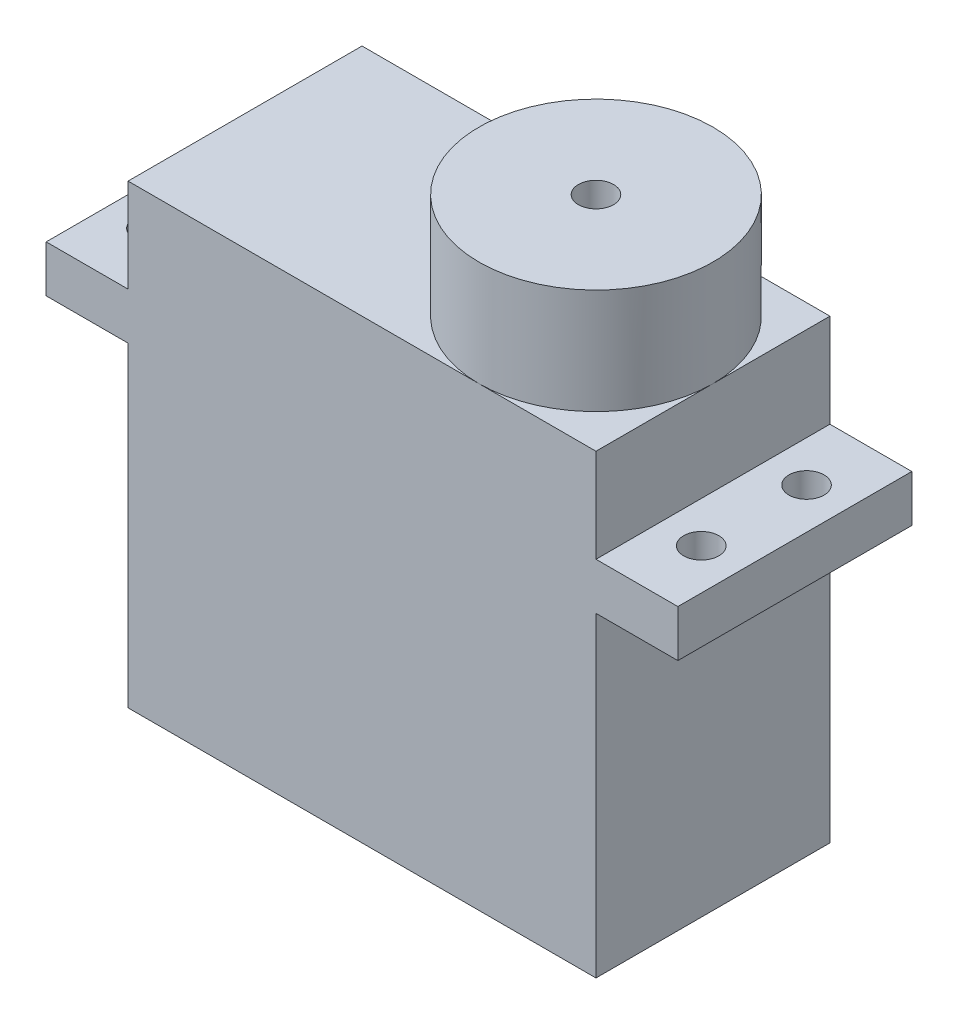
from build123d import *

# Parameters (mm, degrees)
SKETCH_1_W          = 40
SKETCH_1_H          = 20
EXTRUDE_1_DEPTH     = 39
SKETCH_2_W          = 20
SKETCH_2_H          = 4
EXTRUDE_2_DEPTH     = 7
SKETCH_3_R          = 1.5
CUT_EXTRUDE_1_DEPTH = 4
SKETCH_4_W          = 7
SKETCH_4_H          = 4
EXTRUDE_3_DEPTH     = 20
SKETCH_5_R          = 1.5
CUT_EXTRUDE_2_DEPTH = 4
SKETCH_6_R          = 10
EXTRUDE_4_DEPTH     = 9
SKETCH_7_R          = 1.5
CUT_EXTRUDE_3_DEPTH = 6


with BuildPart() as part:
    # Эскиз1 → Бобышка-Вытянуть1 (new body)
    with BuildSketch(Plane(origin=(0, 0, 0), x_dir=(1, 0, 0), z_dir=(0, 1, 0))):
        Rectangle(SKETCH_1_W, SKETCH_1_H)
    extrude(amount=EXTRUDE_1_DEPTH)

    # Эскиз2 → Бобышка-Вытянуть2 (add)
    with BuildSketch(Plane(origin=(20, 0, 0), x_dir=(0, 0, -1), z_dir=(1, 0, 0))):
        with Locations((0, 29)):
            Rectangle(SKETCH_2_W, SKETCH_2_H)
    extrude(amount=EXTRUDE_2_DEPTH)

    # Эскиз3 → Вырез-Вытянуть1 (cut)
    with BuildSketch(Plane(origin=(0, 31, 0), x_dir=(1, 0, 0), z_dir=(0, 1, 0))):
        with Locations(Location((23.5, 4.5, 0), (0, 0, 270))):
            Circle(SKETCH_3_R)
        with Locations(Location((23.5, -4.5, 0), (0, 0, 270))):
            Circle(SKETCH_3_R)
    extrude(amount=-CUT_EXTRUDE_1_DEPTH, mode=Mode.SUBTRACT)

    # Эскиз4 → Бобышка-Вытянуть3 (add)
    with BuildSketch(Plane.XY.offset(10)):
        with Locations((-23.5, 29)):
            Rectangle(SKETCH_4_W, SKETCH_4_H)
    extrude(amount=-EXTRUDE_3_DEPTH)

    # Эскиз5 → Вырез-Вытянуть2 (cut)
    with BuildSketch(Plane(origin=(0, 31, 0), x_dir=(1, 0, 0), z_dir=(0, 1, 0))):
        with Locations(Location((-23.5, -4.5, 0), (0, 0, 270))):
            Circle(SKETCH_5_R)
        with Locations(Location((-23.5, 4.5, 0), (0, 0, 270))):
            Circle(SKETCH_5_R)
    extrude(amount=-CUT_EXTRUDE_2_DEPTH, mode=Mode.SUBTRACT)

    # Эскиз6 → Бобышка-Вытянуть4 (add)
    with BuildSketch(Plane(origin=(0, 39, 0), x_dir=(1, 0, 0), z_dir=(0, 1, 0))):
        with Locations(Location((10, 0, 0), (0, 0, 270))):
            Circle(SKETCH_6_R)
    extrude(amount=EXTRUDE_4_DEPTH)

    # Эскиз7 → Вырез-Вытянуть3 (cut)
    with BuildSketch(Plane(origin=(0, 48, 0), x_dir=(1, 0, 0), z_dir=(0, 1, 0))):
        with Locations(Location((10, 0, 0), (0, 0, 270))):
            Circle(SKETCH_7_R)
    extrude(amount=-CUT_EXTRUDE_3_DEPTH, mode=Mode.SUBTRACT)


solid = part.part
